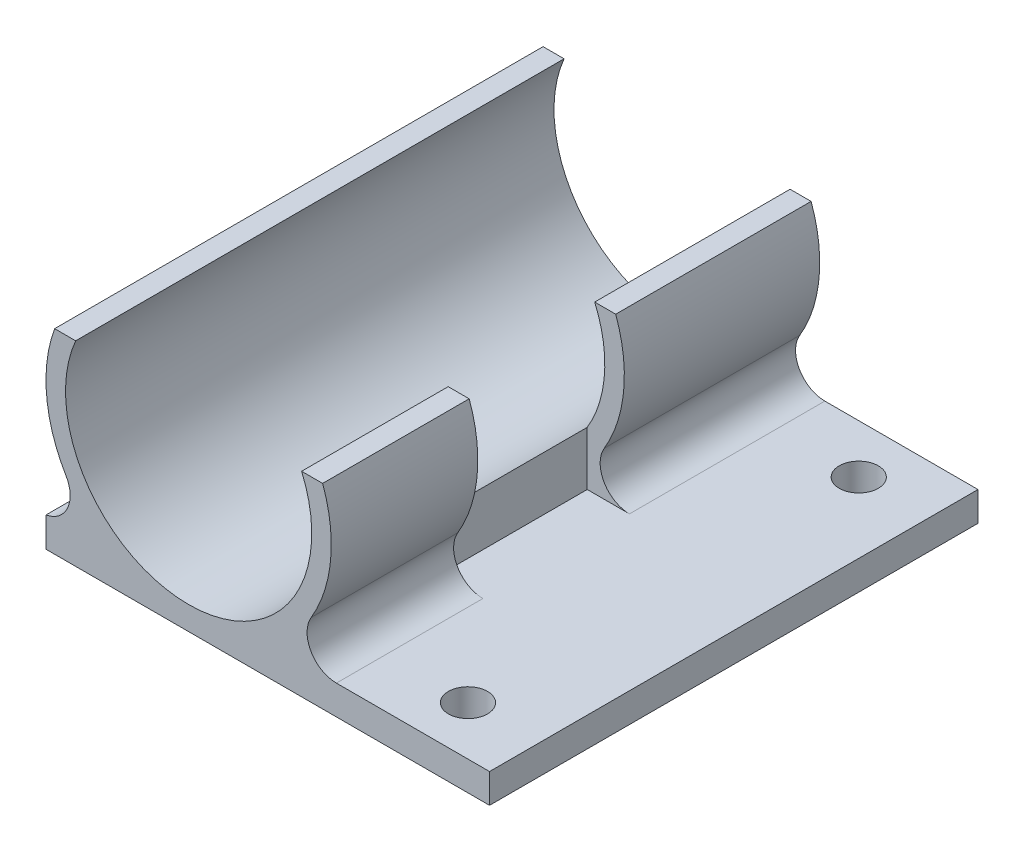
from build123d import *

# Parameters (mm, degrees)
BOSS_EXTRUDE1_DEPTH = 50
SKETCH2_W           = 15
SKETCH2_H           = 20.436302067
CUT_EXTRUDE1_DEPTH  = 20
SKETCH3_R           = 2
CUT_EXTRUDE2_DEPTH  = 76.033433569


with BuildPart() as part:
    # Sketch1 → Boss-Extrude1 (new body)
    with BuildSketch(Plane.XY):
        with BuildLine():
            Line((34.065465836, 5), (36.21714256, 5))
            ThreePointArc((36.21714256, 5), (37.036070696, -1.364788891), (35.046720745, -7.465909091))
            ThreePointArc((35.046720745, -7.465909091), (35.016915208, -10.48285658), (37.624814048, -12))
            Line((37.624814048, -12), (53.301183412, -12))
            Line((53.301183412, -12), (53.301183412, -15))
            Line((53.301183412, -15), (7.9, -15))
            Line((7.9, -15), (7.9, -11.953738346))
            ThreePointArc((7.9, -11.953738346), (10.103218459, -10.248134062), (9.953279255, -7.465909091))
            ThreePointArc((9.953279255, -7.465909091), (7.963929304, -1.364788891), (8.78285744, 5))
            Line((8.78285744, 5), (10.934534164, 5))
            ThreePointArc((10.934534164, 5), (22.5, -12.6), (34.065465836, 5))
        make_face()
    extrude(amount=BOSS_EXTRUDE1_DEPTH)

    # Sketch2 → Cut-Extrude1 (cut)
    with BuildSketch(Plane(origin=(53.301183412, 0, 0), x_dir=(0, 0, -1), z_dir=(1, 0, 0))):
        with Locations((-27.5, -1.781848967)):
            Rectangle(SKETCH2_W, SKETCH2_H)
    extrude(amount=-CUT_EXTRUDE1_DEPTH, mode=Mode.SUBTRACT)

    # Sketch3 → Cut-Extrude2 (cut, through all)
    with BuildSketch(Plane(origin=(0, -12, 0), x_dir=(1, 0, 0), z_dir=(0, 1, 0))):
        with Locations(Location((46.094817468, -45, 0), (0, 0, 180))):
            Circle(SKETCH3_R)
        with Locations(Location((46.094817468, -5, 0), (0, 0, 180))):
            Circle(SKETCH3_R)
    extrude(amount=-CUT_EXTRUDE2_DEPTH, mode=Mode.SUBTRACT)


solid = part.part
